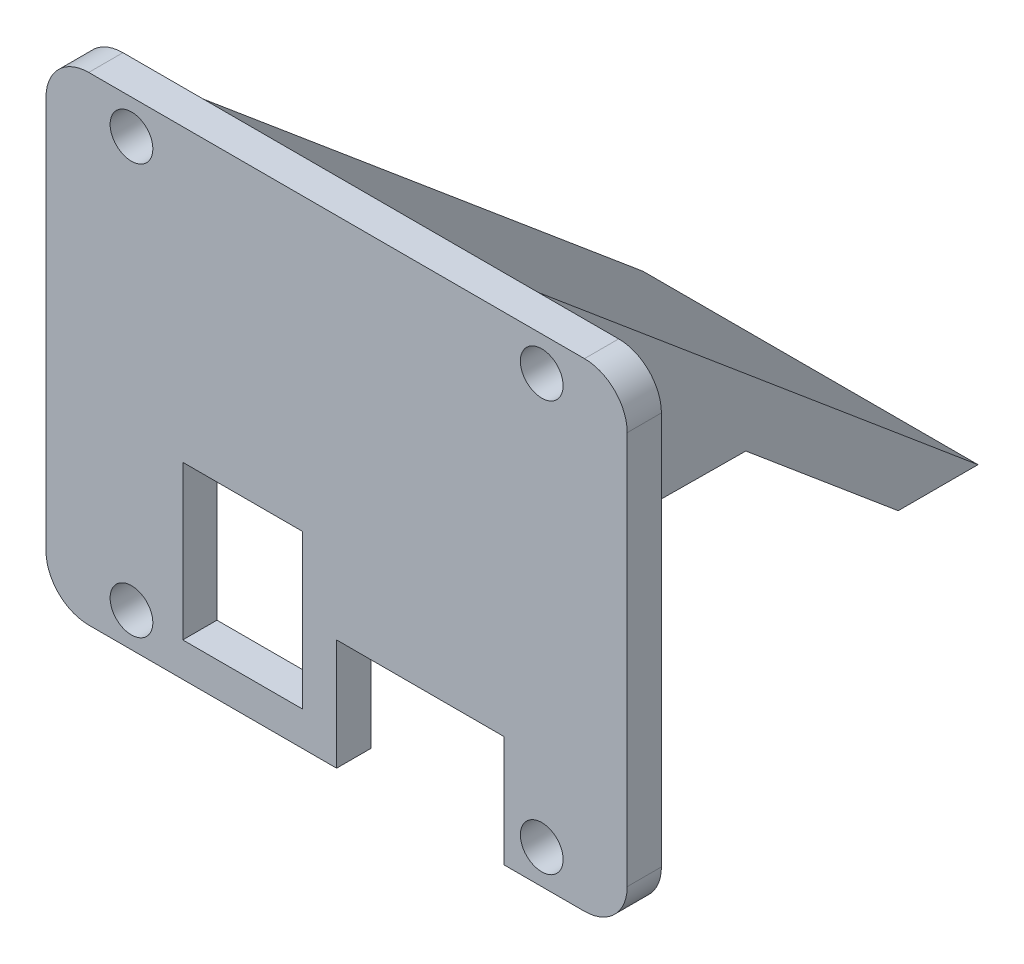
from build123d import *

# Parameters (mm, degrees)
SKETCH_1_W           = 40
SKETCH_1_H           = 32
SKETCH_1_R           = 1.15
EXTRUDE_1_DEPTH      = 3
SKETCH_2_W           = 9.8
SKETCH_2_H           = 5
CUT_EXTRUDE_1_DEPTH  = 3
SKETCH_3_W           = 40
SKETCH_3_H           = 32
SKETCH_3_W_2         = 34
SKETCH_3_H_2         = 28
CUT_EXTRUDE_2_DEPTH  = 3
SKETCH_4_R           = 1.15
EXTRUDE_2_DEPTH      = 1
EXTRUDE_3_DEPTH      = 1
EXTRUDE_5_DEPTH      = 26.8
CUT_EXTRUDE_5_DEPTH  = 7.2
SKETCH_8_W           = 7.003091986
SKETCH_8_H           = 2.463874749
CUT_EXTRUDE_6_DEPTH  = 20
CUT_EXTRUDE_START    = -1
SKETCH_10_R          = 1.15
CUT_EXTRUDE_7_DEPTH  = 1
EXTRUDE_START        = -3
SKETCH_11_R          = 1.15
EXTRUDE_6_DEPTH      = 3
CUT_EXTRUDE_8_DEPTH  = 10
EXTRUDE_START_2      = 1
SKETCH_13_R          = 2
SKETCH_13_R_2        = 1.25
EXTRUDE_9_DEPTH      = 1
SKETCH_14_W          = 8
SKETCH_14_H          = 3
CUT_EXTRUDE_10_DEPTH = 1.5
FILLET_1_R           = 2.5
SKETCH_15_W          = 9.8
SKETCH_15_H          = 1.5
CUT_EXTRUDE_11_DEPTH = 10
EXTRUDE_10_DEPTH     = 1.5
EXTRUDE_11_DEPTH     = 1
SKETCH_18_W          = 36.501584598
SKETCH_18_H          = 29.005250462
CUT_EXTRUDE_12_DEPTH = 2
SKETCH_19_W          = 7
SKETCH_19_H          = 9
CUT_EXTRUDE_13_DEPTH = 2


with BuildPart() as part:
    # 스케치1 → 보스-돌출1 (new body)
    with BuildSketch(Plane.XY):
        Rectangle(SKETCH_1_W, SKETCH_1_H)
        with Locations((-11.5, 11.5)):
            Circle(SKETCH_1_R, mode=Mode.SUBTRACT)
        with Locations((11.5, 11.5)):
            Circle(SKETCH_1_R, mode=Mode.SUBTRACT)
        with Locations((11.5, -11.5)):
            Circle(SKETCH_1_R, mode=Mode.SUBTRACT)
        with Locations((-11.5, -11.5)):
            Circle(SKETCH_1_R, mode=Mode.SUBTRACT)
    extrude(amount=EXTRUDE_1_DEPTH)

    # 스케치2 → 컷-돌출1 (cut)
    with BuildSketch(Plane.XY.offset(3)):
        with Locations((4.9, -11.5)):
            Rectangle(SKETCH_2_W, SKETCH_2_H)
    extrude(amount=-CUT_EXTRUDE_1_DEPTH, mode=Mode.SUBTRACT)

    # 스케치3 → 컷-돌출2 (cut)
    with BuildSketch(Plane.XY.offset(3)):
        Rectangle(SKETCH_3_W, SKETCH_3_H)
        Rectangle(SKETCH_3_W_2, SKETCH_3_H_2, mode=Mode.SUBTRACT)
    extrude(amount=-CUT_EXTRUDE_2_DEPTH, mode=Mode.SUBTRACT)

    # 스케치4 → 보스-돌출2 (add)
    # profile 1 of 13: a face of its own
    with BuildSketch(Plane.XY.offset(3)):
        with BuildLine():
            ThreePointArc((11.5, 14), (9.732233047, 13.267766953), (9, 11.5))
            Line((9, 11.5), (10.35, 11.5))
            ThreePointArc((10.35, 11.5), (11.5, 12.65), (12.65, 11.5))
            Line((12.65, 11.5), (14, 11.5))
            ThreePointArc((14, 11.5), (13.267766953, 13.267766953), (11.5, 14))
        make_face()
    # profile 2 of 13: a face of its own
    with BuildSketch(Plane.XY.offset(3)):
        with BuildLine():
            Line((10.35, 11.5), (9, 11.5))
            ThreePointArc((9, 11.5), (11.5, 9), (14, 11.5))
            Line((14, 11.5), (12.65, 11.5))
            ThreePointArc((12.65, 11.5), (11.5, 10.35), (10.35, 11.5))
        make_face()
    # profile 3 of 13: a face of its own
    with BuildSketch(Plane.XY.offset(3)):
        with BuildLine():
            ThreePointArc((11.5, 14), (9.732233047, 13.267766953), (9, 11.5))
            Line((9, 11.5), (10.35, 11.5))
            ThreePointArc((10.35, 11.5), (11.5, 12.65), (12.65, 11.5))
            Line((12.65, 11.5), (14, 11.5))
            ThreePointArc((14, 11.5), (13.267766953, 13.267766953), (11.5, 14))
        make_face()
    # profile 4 of 13: a face of its own
    with BuildSketch(Plane.XY.offset(3)):
        with BuildLine():
            Line((10.35, 11.5), (9, 11.5))
            ThreePointArc((9, 11.5), (11.5, 9), (14, 11.5))
            Line((14, 11.5), (12.65, 11.5))
            ThreePointArc((12.65, 11.5), (11.5, 10.35), (10.35, 11.5))
        make_face()
    # profile 5 of 13: a face of its own
    with BuildSketch(Plane.XY.offset(3)):
        with BuildLine():
            ThreePointArc((-11.5, 14), (-13.267766953, 13.267766953), (-14, 11.5))
            Line((-14, 11.5), (-12.65, 11.5))
            ThreePointArc((-12.65, 11.5), (-11.5, 12.65), (-10.35, 11.5))
            Line((-10.35, 11.5), (-9, 11.5))
            ThreePointArc((-9, 11.5), (-9.732233047, 13.267766953), (-11.5, 14))
        make_face()
    # profile 6 of 13: a face of its own
    with BuildSketch(Plane.XY.offset(3)):
        with BuildLine():
            Line((-12.65, 11.5), (-14, 11.5))
            ThreePointArc((-14, 11.5), (-11.5, 9), (-9, 11.5))
            Line((-9, 11.5), (-10.35, 11.5))
            ThreePointArc((-10.35, 11.5), (-11.5, 10.35), (-12.65, 11.5))
        make_face()
    # profile 7 of 13: a face of its own
    with BuildSketch(Plane.XY.offset(3)):
        with BuildLine():
            ThreePointArc((-11.5, 14), (-13.267766953, 13.267766953), (-14, 11.5))
            Line((-14, 11.5), (-12.65, 11.5))
            ThreePointArc((-12.65, 11.5), (-11.5, 12.65), (-10.35, 11.5))
            Line((-10.35, 11.5), (-9, 11.5))
            ThreePointArc((-9, 11.5), (-9.732233047, 13.267766953), (-11.5, 14))
        make_face()
    # profile 8 of 13: a face of its own
    with BuildSketch(Plane.XY.offset(3)):
        with BuildLine():
            Line((-12.65, 11.5), (-14, 11.5))
            ThreePointArc((-14, 11.5), (-11.5, 9), (-9, 11.5))
            Line((-9, 11.5), (-10.35, 11.5))
            ThreePointArc((-10.35, 11.5), (-11.5, 10.35), (-12.65, 11.5))
        make_face()
    # profile 9 of 13: a face of its own
    with BuildSketch(Plane.XY.offset(3)):
        with BuildLine():
            ThreePointArc((-9, -11.5), (-11.5, -9), (-14, -11.5))
            Line((-14, -11.5), (-12.65, -11.5))
            ThreePointArc((-12.65, -11.5), (-11.5, -10.35), (-10.35, -11.5))
            Line((-10.35, -11.5), (-9, -11.5))
        make_face()
    # profile 10 of 13: a face of its own
    with BuildSketch(Plane.XY.offset(3)):
        with BuildLine():
            Line((-12.65, -11.5), (-14, -11.5))
            ThreePointArc((-14, -11.5), (-13.267766953, -13.267766953), (-11.5, -14))
            ThreePointArc((-11.5, -14), (-9.732233047, -13.267766953), (-9, -11.5))
            Line((-9, -11.5), (-10.35, -11.5))
            ThreePointArc((-10.35, -11.5), (-11.5, -12.65), (-12.65, -11.5))
        make_face()
    # profile 11 of 13: a face of its own
    with BuildSketch(Plane.XY.offset(3)):
        with BuildLine():
            ThreePointArc((-9, -11.5), (-11.5, -9), (-14, -11.5))
            Line((-14, -11.5), (-12.65, -11.5))
            ThreePointArc((-12.65, -11.5), (-11.5, -10.35), (-10.35, -11.5))
            Line((-10.35, -11.5), (-9, -11.5))
        make_face()
    # profile 12 of 13: a face of its own
    with BuildSketch(Plane.XY.offset(3)):
        with BuildLine():
            Line((-12.65, -11.5), (-14, -11.5))
            ThreePointArc((-14, -11.5), (-13.267766953, -13.267766953), (-11.5, -14))
            ThreePointArc((-11.5, -14), (-9.732233047, -13.267766953), (-9, -11.5))
            Line((-9, -11.5), (-10.35, -11.5))
            ThreePointArc((-10.35, -11.5), (-11.5, -12.65), (-12.65, -11.5))
        make_face()
    # profile 13 of 13: a face of its own
    with BuildSketch(Plane.XY.offset(3)):
        with BuildLine():
            Line((9.8, -9.666969722), (9.8, -13.333030278))
            ThreePointArc((9.8, -13.333030278), (10.586921607, -13.827291956), (11.5, -14))
            ThreePointArc((11.5, -14), (13.267766953, -13.267766953), (14, -11.5))
            ThreePointArc((14, -11.5), (12.5, -9.208712153), (9.8, -9.666969722))
        make_face()
        with Locations((11.5, -11.5)):
            Circle(SKETCH_4_R, mode=Mode.SUBTRACT)
    extrude(amount=EXTRUDE_2_DEPTH)

    # 스케치5 → 보스-돌출3 (add)
    with BuildSketch(Plane.XY.offset(3)):
        with BuildLine():
            Line((14, -14), (14, -11.5))
            ThreePointArc((14, -11.5), (13.267766953, -13.267766953), (11.5, -14))
            Line((11.5, -14), (14, -14))
        make_face()
        with BuildLine():
            ThreePointArc((-11.5, -14), (-13.267766953, -13.267766953), (-14, -11.5))
            Line((-14, -11.5), (-14, -14))
            Line((-14, -14), (-11.5, -14))
        make_face()
        with BuildLine():
            Line((-9, -14), (-9, -11.5))
            ThreePointArc((-9, -11.5), (-9.732233047, -13.267766953), (-11.5, -14))
            Line((-11.5, -14), (-9, -14))
        make_face()
        with BuildLine():
            ThreePointArc((-14, 11.5), (-13.267766953, 13.267766953), (-11.5, 14))
            Line((-11.5, 14), (-14, 14))
            Line((-14, 14), (-14, 11.5))
        make_face()
        with BuildLine():
            Line((-9, 11.5), (-9, 14))
            Line((-9, 14), (-11.5, 14))
            ThreePointArc((-11.5, 14), (-9.732233047, 13.267766953), (-9, 11.5))
        make_face()
        with BuildLine():
            ThreePointArc((9, 11.5), (9.732233047, 13.267766953), (11.5, 14))
            Line((11.5, 14), (9, 14))
            Line((9, 14), (9, 11.5))
        make_face()
        with BuildLine():
            ThreePointArc((11.5, 14), (13.267766953, 13.267766953), (14, 11.5))
            Line((14, 11.5), (14, 14))
            Line((14, 14), (11.5, 14))
        make_face()
        with BuildLine():
            Line((14, -11.5), (12.65, -11.5))
            ThreePointArc((12.65, -11.5), (11.5, -12.65), (10.35, -11.5))
            Line((10.35, -11.5), (9.8, -11.5))
            Line((9.8, -11.5), (9.8, -14))
            Line((9.8, -14), (11.5, -14))
            ThreePointArc((11.5, -14), (13.267766953, -13.267766953), (14, -11.5))
        make_face()
    extrude(amount=EXTRUDE_3_DEPTH)

    # 스케치6 → 보스-돌출5 (add)
    with BuildSketch(Plane.ZY.offset(17)):
        Polygon((-22.981333294, -5.283628291), (-21.052970465, -7.58176162), (-26.811555509, -8.497566339), align=None)
        Polygon((-9.562303818, 2.060052525), (0, 10.083778132), (0, 14), (-22.981333294, -5.283628291), (-21.052970465, -7.58176162), (-12.137495761, -0.100790085), align=None)
        Polygon((-12.137495761, -0.100790085), (0, 0), (0, 10.083778132), (-9.562303818, 2.060052525), align=None)
    extrude(amount=-EXTRUDE_5_DEPTH)

    # 스케치7 → 컷-돌출5 (cut)
    with BuildSketch(Plane.ZY.offset(17)):
        Polygon((0, 0), (0, 14), (-26.811555509, -8.497566339), (-21.052970465, -7.58176162), (-12.137495761, -0.100790085), align=None)
    extrude(amount=-CUT_EXTRUDE_5_DEPTH, mode=Mode.SUBTRACT)

    # 스케치8 → 컷-돌출6 (cut)
    with BuildSketch(Plane.ZY.offset(9.8)):
        with Locations((-24.554516458, -8.813698995)):
            Rectangle(SKETCH_8_W, SKETCH_8_H)
    extrude(amount=-CUT_EXTRUDE_6_DEPTH, mode=Mode.SUBTRACT)

    # 스케치10 → 컷-돌출7 (cut)
    # profile 1 of 4: a face of its own
    with BuildSketch(Plane.XY.offset(4).offset(CUT_EXTRUDE_START)):
        with BuildLine():
            Line((-14, -11.5), (-14, -14))
            Line((-14, -14), (-9, -14))
            Line((-9, -14), (-9, -11.5))
            ThreePointArc((-9, -11.5), (-11.5, -9), (-14, -11.5))
        make_face()
        with Locations((-11.5, -11.5)):
            Circle(SKETCH_10_R, mode=Mode.SUBTRACT)
    # profile 2 of 4: a face of its own
    with BuildSketch(Plane.XY.offset(4).offset(CUT_EXTRUDE_START)):
        with BuildLine():
            Line((-14, 14), (-14, 11.5))
            ThreePointArc((-14, 11.5), (-11.5, 9), (-9, 11.5))
            Line((-9, 11.5), (-9, 14))
            Line((-9, 14), (-14, 14))
        make_face()
        with Locations((-11.5, 11.5)):
            Circle(SKETCH_10_R, mode=Mode.SUBTRACT)
    # profile 3 of 4: a face of its own
    with BuildSketch(Plane.XY.offset(4).offset(CUT_EXTRUDE_START)):
        with BuildLine():
            Line((9.8, -14), (14, -14))
            Line((14, -14), (14, -11.5))
            ThreePointArc((14, -11.5), (12.5, -9.208712153), (9.8, -9.666969722))
            Line((9.8, -9.666969722), (9.8, -14))
        make_face()
        with Locations((11.5, -11.5)):
            Circle(SKETCH_10_R, mode=Mode.SUBTRACT)
    # profile 4 of 4: a face of its own
    with BuildSketch(Plane.XY.offset(4).offset(CUT_EXTRUDE_START)):
        with BuildLine():
            Line((9, 14), (9, 11.5))
            ThreePointArc((9, 11.5), (11.5, 9), (14, 11.5))
            Line((14, 11.5), (14, 14))
            Line((14, 14), (9, 14))
        make_face()
        with Locations((11.5, 11.5)):
            Circle(SKETCH_10_R, mode=Mode.SUBTRACT)
    extrude(amount=CUT_EXTRUDE_7_DEPTH, mode=Mode.SUBTRACT)

    # 스케치11 → 보스-돌출6 (add)
    with BuildSketch(Plane.XY.offset(3).offset(EXTRUDE_START)):
        with Locations((-11.5, 11.5)):
            Circle(SKETCH_11_R)
        with Locations((11.5, 11.5)):
            Circle(SKETCH_11_R)
        with Locations((11.5, -11.5)):
            Circle(SKETCH_11_R)
        with Locations((-11.5, -11.5)):
            Circle(SKETCH_11_R)
    extrude(amount=EXTRUDE_6_DEPTH)

    # 스케치12 → 컷-돌출8 (cut)
    with BuildSketch(Plane.XY.offset(3)):
        with BuildLine():
            ThreePointArc((-10.75, 12), (-12.883883476, 12.883883476), (-12, 10.75))
            Line((-12, 10.75), (-12, 12))
            Line((-12, 12), (-10.75, 12))
        make_face()
        with BuildLine():
            Line((-12, 12), (-12, 10.75))
            ThreePointArc((-12, 10.75), (-11.116116524, 11.116116524), (-10.75, 12))
            Line((-10.75, 12), (-12, 12))
        make_face()
        with BuildLine():
            ThreePointArc((-10.75, 12), (-12.883883476, 12.883883476), (-12, 10.75))
            Line((-12, 10.75), (-12, 12))
            Line((-12, 12), (-10.75, 12))
        make_face()
        with BuildLine():
            Line((-12, 12), (-12, 10.75))
            ThreePointArc((-12, 10.75), (-11.116116524, 11.116116524), (-10.75, 12))
            Line((-10.75, 12), (-12, 12))
        make_face()
        with BuildLine():
            ThreePointArc((10.75, 12), (11.116116524, 11.116116524), (12, 10.75))
            Line((12, 10.75), (12, 12))
            Line((12, 12), (10.75, 12))
        make_face()
        with BuildLine():
            Line((12, 12), (12, 10.75))
            ThreePointArc((12, 10.75), (12.883883476, 11.116116524), (13.25, 12))
            ThreePointArc((13.25, 12), (12, 13.25), (10.75, 12))
            Line((10.75, 12), (12, 12))
        make_face()
        with BuildLine():
            ThreePointArc((10.75, 12), (11.116116524, 11.116116524), (12, 10.75))
            Line((12, 10.75), (12, 12))
            Line((12, 12), (10.75, 12))
        make_face()
        with BuildLine():
            Line((12, 12), (12, 10.75))
            ThreePointArc((12, 10.75), (12.883883476, 11.116116524), (13.25, 12))
            ThreePointArc((13.25, 12), (12, 13.25), (10.75, 12))
            Line((10.75, 12), (12, 12))
        make_face()
        with BuildLine():
            ThreePointArc((12, -10.75), (11.116116524, -11.116116524), (10.75, -12))
            Line((10.75, -12), (12, -12))
            Line((12, -12), (12, -10.75))
        make_face()
        with BuildLine():
            Line((12, -12), (10.75, -12))
            ThreePointArc((10.75, -12), (12, -13.25), (13.25, -12))
            ThreePointArc((13.25, -12), (12.883883476, -11.116116524), (12, -10.75))
            Line((12, -10.75), (12, -12))
        make_face()
        with BuildLine():
            ThreePointArc((12, -10.75), (11.116116524, -11.116116524), (10.75, -12))
            Line((10.75, -12), (12, -12))
            Line((12, -12), (12, -10.75))
        make_face()
        with BuildLine():
            Line((12, -12), (10.75, -12))
            ThreePointArc((10.75, -12), (12, -13.25), (13.25, -12))
            ThreePointArc((13.25, -12), (12.883883476, -11.116116524), (12, -10.75))
            Line((12, -10.75), (12, -12))
        make_face()
        with BuildLine():
            Line((-12, -10.75), (-12, -12))
            Line((-12, -12), (-10.75, -12))
            ThreePointArc((-10.75, -12), (-11.116116524, -11.116116524), (-12, -10.75))
        make_face()
        with BuildLine():
            Line((-10.75, -12), (-12, -12))
            Line((-12, -12), (-12, -10.75))
            ThreePointArc((-12, -10.75), (-12.883883476, -12.883883476), (-10.75, -12))
        make_face()
        with BuildLine():
            Line((-12, -10.75), (-12, -12))
            Line((-12, -12), (-10.75, -12))
            ThreePointArc((-10.75, -12), (-11.116116524, -11.116116524), (-12, -10.75))
        make_face()
        with BuildLine():
            Line((-10.75, -12), (-12, -12))
            Line((-12, -12), (-12, -10.75))
            ThreePointArc((-12, -10.75), (-12.883883476, -12.883883476), (-10.75, -12))
        make_face()
    extrude(amount=-CUT_EXTRUDE_8_DEPTH, mode=Mode.SUBTRACT)

    # 스케치13 → 보스-돌출9 (add)
    # profile 1 of 12: a face of its own
    with BuildSketch(Plane.XY.offset(3).offset(EXTRUDE_START_2)):
        with BuildLine():
            ThreePointArc((12, 14), (13.414213562, 13.414213562), (14, 12))
            Line((14, 12), (14, 14))
            Line((14, 14), (12, 14))
        make_face()
    # profile 2 of 12: a face of its own
    with BuildSketch(Plane.XY.offset(3).offset(EXTRUDE_START_2)):
        with BuildLine():
            Line((10, 14), (10, 12))
            ThreePointArc((10, 12), (10.585786438, 13.414213562), (12, 14))
            Line((12, 14), (10, 14))
        make_face()
    # profile 3 of 12: a face of its own
    with BuildSketch(Plane.XY.offset(3).offset(EXTRUDE_START_2)):
        with Locations((12, 12)):
            Circle(SKETCH_13_R)
        with Locations((12, 12)):
            Circle(SKETCH_13_R_2, mode=Mode.SUBTRACT)
    # profile 4 of 12: a face of its own
    with BuildSketch(Plane.XY.offset(3).offset(EXTRUDE_START_2)):
        with BuildLine():
            Line((-10, 12), (-10, 14))
            Line((-10, 14), (-11.999999991, 14))
            ThreePointArc((-11.999999991, 14), (-10.585786434, 13.414213559), (-10, 12))
        make_face()
    # profile 5 of 12: a face of its own
    with BuildSketch(Plane.XY.offset(3).offset(EXTRUDE_START_2)):
        with BuildLine():
            ThreePointArc((-14, 12), (-13.414213559, 13.414213566), (-11.999999991, 14))
            Line((-11.999999991, 14), (-14, 14))
            Line((-14, 14), (-14, 12))
        make_face()
    # profile 6 of 12: a face of its own
    with BuildSketch(Plane.XY.offset(3).offset(EXTRUDE_START_2)):
        with Locations((-12, 12)):
            Circle(SKETCH_13_R)
        with Locations((-12, 12)):
            Circle(SKETCH_13_R_2, mode=Mode.SUBTRACT)
    # profile 7 of 12: a face of its own
    with BuildSketch(Plane.XY.offset(3).offset(EXTRUDE_START_2)):
        with Locations((-12, -12)):
            Circle(SKETCH_13_R)
        with Locations((-12, -12)):
            Circle(SKETCH_13_R_2, mode=Mode.SUBTRACT)
    # profile 8 of 12: a face of its own
    with BuildSketch(Plane.XY.offset(3).offset(EXTRUDE_START_2)):
        with BuildLine():
            Line((-10, -14), (-10, -12))
            ThreePointArc((-10, -12), (-10.585786438, -13.414213562), (-12, -14))
            Line((-12, -14), (-10, -14))
        make_face()
    # profile 9 of 12: a face of its own
    with BuildSketch(Plane.XY.offset(3).offset(EXTRUDE_START_2)):
        with BuildLine():
            ThreePointArc((-12, -14), (-13.414213562, -13.414213562), (-14, -12))
            Line((-14, -12), (-14, -14))
            Line((-14, -14), (-12, -14))
        make_face()
    # profile 10 of 12: a face of its own
    with BuildSketch(Plane.XY.offset(3).offset(EXTRUDE_START_2)):
        with BuildLine():
            Line((14, -14), (14, -12))
            ThreePointArc((14, -12), (13.414213562, -13.414213562), (12, -14))
            Line((12, -14), (14, -14))
        make_face()
    # profile 11 of 12: a face of its own
    with BuildSketch(Plane.XY.offset(3).offset(EXTRUDE_START_2)):
        with BuildLine():
            ThreePointArc((12, -14), (10.585786438, -13.414213562), (10, -12))
            Line((10, -12), (10, -14))
            Line((10, -14), (12, -14))
        make_face()
    # profile 12 of 12: a face of its own
    with BuildSketch(Plane.XY.offset(3).offset(EXTRUDE_START_2)):
        with Locations((12, -12)):
            Circle(SKETCH_13_R)
        with Locations((12, -12)):
            Circle(SKETCH_13_R_2, mode=Mode.SUBTRACT)
    extrude(amount=-EXTRUDE_9_DEPTH)

    # 스케치14 → 컷-돌출10 (cut)
    with BuildSketch(Plane.XY.offset(3)):
        Polygon((9.8, -9), (9.8, -9.75), (16, -9.75), (16, 9.75), (-16, 9.75), (-16, -9.75), (-8, -9.75), (0, -9.75), (0, -9), align=None)
        with Locations((-4, -11.25)):
            Rectangle(SKETCH_14_W, SKETCH_14_H)
    extrude(amount=-CUT_EXTRUDE_10_DEPTH, mode=Mode.SUBTRACT)

    # 필렛1
    fillet_1_edges = [part.edges().sort_by_distance(p)[0] for p in [
        (-17, -14, 1.5),
        (17, -14, 1.5),
        (-17, 14, 1.5),
        (17, 14, 1.5),
    ]]
    fillet(fillet_1_edges, radius=FILLET_1_R)

    # 스케치15 → 컷-돌출11 (cut)
    with BuildSketch(Plane.XY.offset(1.5)):
        with Locations((4.9, -8.25)):
            Rectangle(SKETCH_15_W, SKETCH_15_H)
    extrude(amount=-CUT_EXTRUDE_11_DEPTH, mode=Mode.SUBTRACT)

    # 스케치16 → 보스-돌출10 (add)
    with BuildSketch(Plane.XY.offset(1.5)):
        Polygon((0, -12.75), (0, -7.5), (9.8, -7.5), (9.8, -9.75), (16, -9.75), (16, 9.75), (-16, 9.75), (-16, -9.75), (-8, -9.75), (-8, -12.75), align=None)
    extrude(amount=EXTRUDE_10_DEPTH)

    # 스케치17 → 보스-돌출11 (add)
    with BuildSketch(Plane.XY.offset(3)):
        with BuildLine():
            Line((0, -7.5), (9.8, -7.5))
            Line((9.8, -7.5), (9.8, -14))
            Line((9.8, -14), (10, -14))
            Line((10, -14), (10, -12))
            ThreePointArc((10, -12), (12, -10), (14, -12))
            Line((14, -12), (14, -14))
            Line((14, -14), (14.5, -14))
            ThreePointArc((14.5, -14), (16.267766953, -13.267766953), (17, -11.5))
            Line((17, -11.5), (17, 11.5))
            ThreePointArc((17, 11.5), (16.267766953, 13.267766953), (14.5, 14))
            Line((14.5, 14), (14, 14))
            Line((14, 14), (14, 12))
            ThreePointArc((14, 12), (12, 10), (10, 12))
            Line((10, 12), (10, 14))
            Line((10, 14), (-10, 14))
            Line((-10, 14), (-10, 12))
            ThreePointArc((-10, 12), (-12, 10), (-14, 12))
            Line((-14, 12), (-14, 14))
            Line((-14, 14), (-14.5, 14))
            ThreePointArc((-14.5, 14), (-16.267766953, 13.267766953), (-17, 11.5))
            Line((-17, 11.5), (-17, -11.5))
            ThreePointArc((-17, -11.5), (-16.267766953, -13.267766953), (-14.5, -14))
            Line((-14.5, -14), (-14, -14))
            Line((-14, -14), (-14, -12))
            ThreePointArc((-14, -12), (-12, -10), (-10, -12))
            Line((-10, -12), (-10, -14))
            Line((-10, -14), (0, -14))
            Line((0, -14), (0, -7.5))
        make_face()
    extrude(amount=EXTRUDE_11_DEPTH)

    # 스케치18 → 컷-돌출12 (cut)
    with BuildSketch(Plane.XY.offset(4)):
        Rectangle(SKETCH_18_W, SKETCH_18_H)
    extrude(amount=-CUT_EXTRUDE_12_DEPTH, mode=Mode.SUBTRACT)

    # 스케치19 → 컷-돌출13 (cut)
    with BuildSketch(Plane.XY.offset(2)):
        with Locations((-5.5, -7.5)):
            Rectangle(SKETCH_19_W, SKETCH_19_H)
    extrude(amount=-CUT_EXTRUDE_13_DEPTH, mode=Mode.SUBTRACT)


solid = part.part
